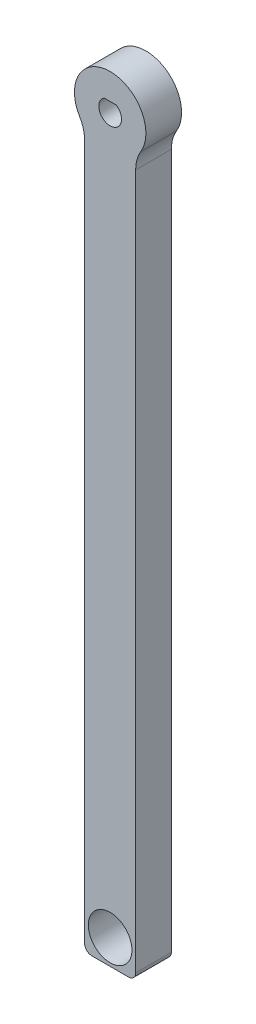
from build123d import *

# Parameters (mm, degrees)
SKETCH1_R           = 10
BOSS_EXTRUDE1_DEPTH = 10
CUT_EXTRUDE1_DEPTH  = 10
SKETCH3_W           = 14.282856858
SKETCH3_H           = 10
BOSS_EXTRUDE2_DEPTH = 200
SKETCH4_R           = 6.11
CUT_EXTRUDE2_DEPTH  = 10
FILLET1_R           = 10
FILLET2_R           = 2


with BuildPart() as part:
    # Sketch1 → Boss-Extrude1 (new body)
    with BuildSketch(Plane.XY):
        Circle(SKETCH1_R)
        with BuildLine():
            ThreePointArc((-1.666643333, 2.72), (0, -3.19), (1.666643333, 2.72))
            Line((1.666643333, 2.72), (-1.666643333, 2.72))
        make_face(mode=Mode.SUBTRACT)
    extrude(amount=BOSS_EXTRUDE1_DEPTH)

    # Sketch2 → Cut-Extrude1 (cut)
    with BuildSketch(Plane(origin=(0, 0, 0), x_dir=(-1, 0, 0), z_dir=(0, 0, -1))):
        with BuildLine():
            Line((7.141428429, -7), (-7.141428429, -7))
            ThreePointArc((-7.141428429, -7), (-3.872983346, -9.219544457), (0, -10))
            ThreePointArc((0, -10), (3.872983346, -9.219544457), (7.141428429, -7))
        make_face()
    extrude(amount=-CUT_EXTRUDE1_DEPTH, mode=Mode.SUBTRACT)

    # Sketch3 → Boss-Extrude2 (add)
    with BuildSketch(Plane.XZ.offset(7)):
        with Locations((0, 5)):
            Rectangle(SKETCH3_W, SKETCH3_H)
    extrude(amount=BOSS_EXTRUDE2_DEPTH)

    # Sketch4 → Cut-Extrude2 (cut)
    with BuildSketch(Plane(origin=(0, 0, 0), x_dir=(-1, 0, 0), z_dir=(0, 0, -1))):
        with Locations((0, -200)):
            Circle(SKETCH4_R)
    extrude(amount=-CUT_EXTRUDE2_DEPTH, mode=Mode.SUBTRACT)

    # Fillet1
    fillet1_edges = [part.edges().sort_by_distance(p)[0] for p in [
        (7.141428429, -7, 5),
        (-7.141428429, -7, 5),
    ]]
    fillet(fillet1_edges, radius=FILLET1_R)

    # Fillet2
    fillet2_edges = [part.edges().sort_by_distance(p)[0] for p in [
        (-7.141428429, -207, 5),
        (7.141428429, -207, 5),
    ]]
    fillet(fillet2_edges, radius=FILLET2_R)


solid = part.part
